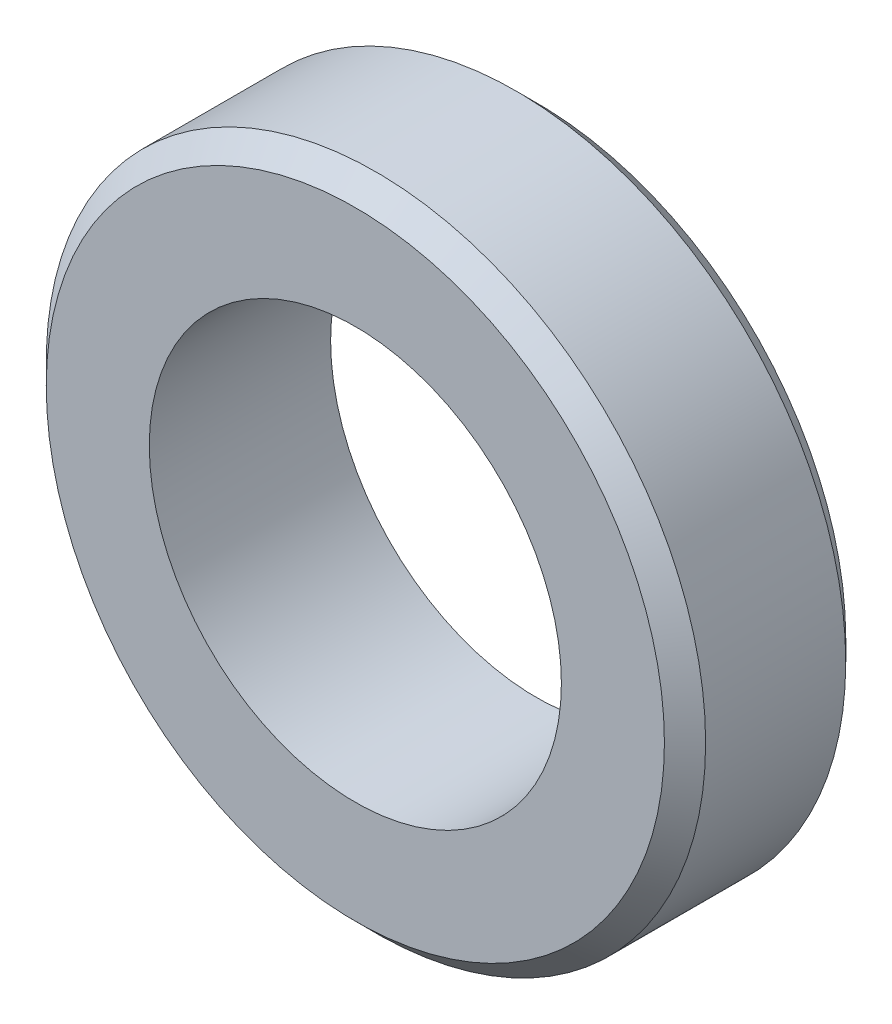
from build123d import *

# Parameters (mm, degrees)
SKETCH1_R           = 12.7
SKETCH1_R_2         = 7.9375
BOSS_EXTRUDE1_DEPTH = 6.985
CHAMFER1_SIZE       = 0.79375


with BuildPart() as part:
    # Sketch1 → Boss-Extrude1 (new body)
    with BuildSketch(Plane.XY):
        Circle(SKETCH1_R)
        Circle(SKETCH1_R_2, mode=Mode.SUBTRACT)
    extrude(amount=BOSS_EXTRUDE1_DEPTH)

    # Chamfer1
    chamfer1_edges = [part.edges().sort_by_distance(p)[0] for p in [
        (-12.7, 0, 0),
        (-12.7, 0, 6.985),
    ]]
    chamfer(chamfer1_edges, length=CHAMFER1_SIZE)


solid = part.part
